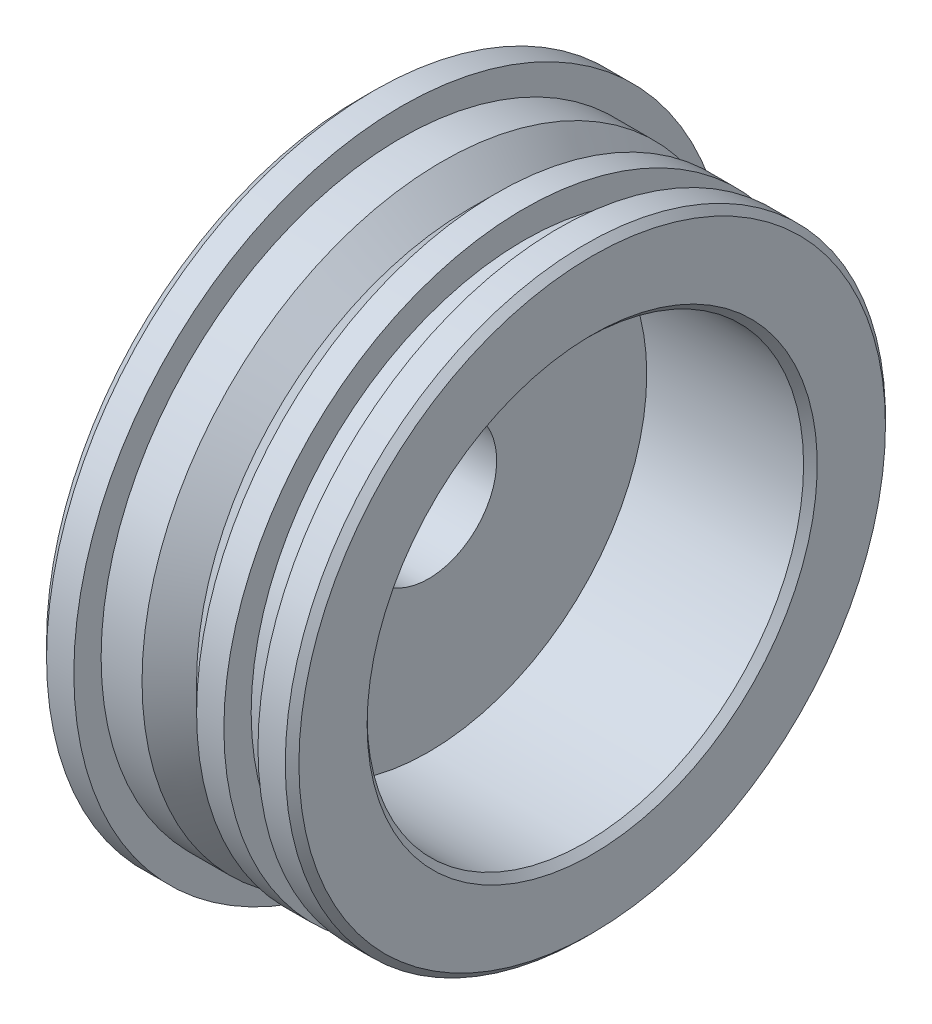
from build123d import *

# Parameters (mm, degrees)
SKETCH_2_R          = 5
CUT_EXTRUDE_1_DEPTH = 10


with BuildPart() as part:
    # Эскиз1 → Повернуть1 (revolve)
    with BuildSketch(Plane.XY, mode=Mode.PRIVATE) as revolve_1_sk:
        Polygon((-5, 0), (-5, 23), (-4, 24), (-2, 24), (-2, 22), (1, 22), (3, 20), (5, 22), (7, 22), (7, 20), (9.5, 20), (9.5, 22), (11.5, 22), (12, 21.5), (12, 16.5), (11.5, 16), (0, 16), (0, 0), align=None)
    revolve(revolve_1_sk.sketch.rotate(Axis((0, 0, 0), (1, 0, 0)), 90), axis=Axis((0, 0, 0), (1, 0, 0)))

    # Эскиз2 → Вырез-Вытянуть1 (cut)
    with BuildSketch(Plane.ZY.offset(5)):
        Circle(SKETCH_2_R)
    extrude(amount=-CUT_EXTRUDE_1_DEPTH, mode=Mode.SUBTRACT)


solid = part.part
